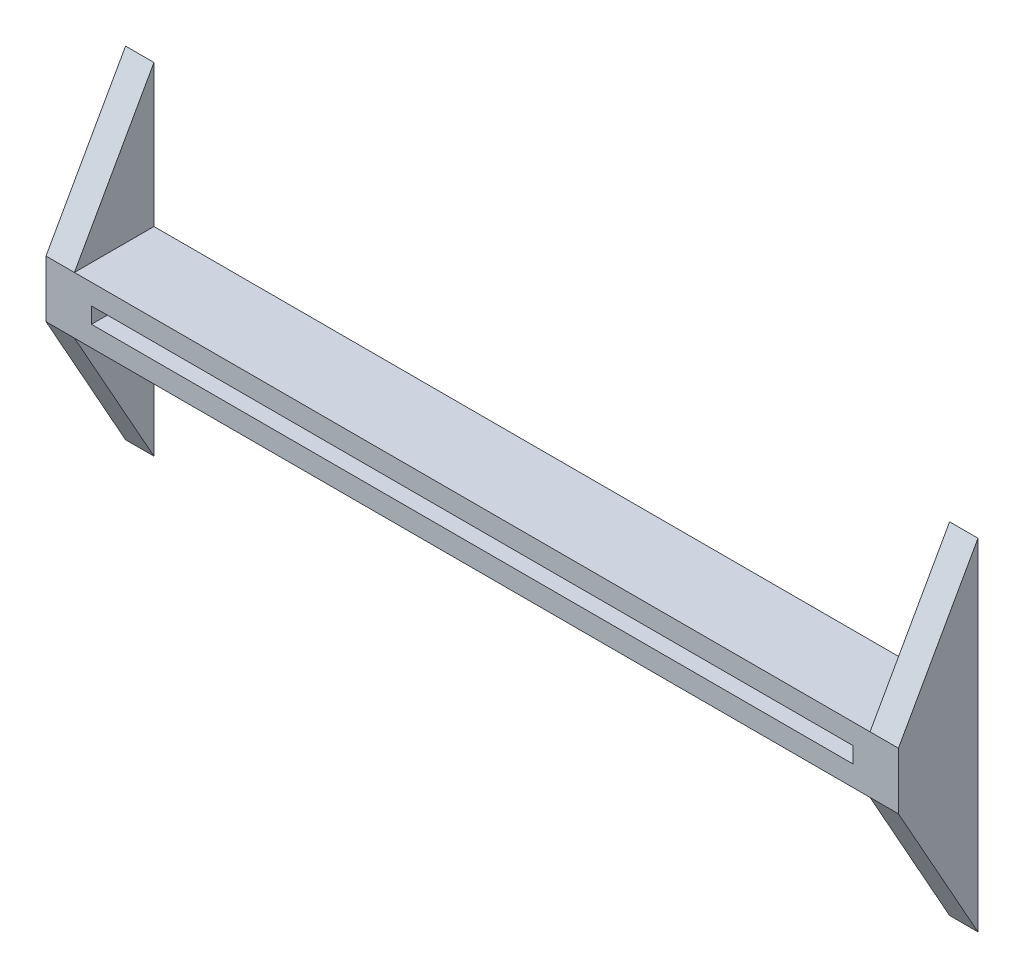
from build123d import *

# Parameters (mm, degrees)
SKETCH1_W           = 70
SKETCH1_H           = 5
SKETCH1_W_2         = 67
SKETCH1_H_2         = 1.4
BOSS_EXTRUDE1_DEPTH = 5
SKETCH2_W           = 70
SKETCH2_H           = 5
BOSS_EXTRUDE2_DEPTH = 2
BOSS_EXTRUDE3_DEPTH = 2.5
BOSS_EXTRUDE4_DEPTH = 2.5


with BuildPart() as part:
    # Sketch1 → Boss-Extrude1 (new body)
    with BuildSketch(Plane.XY):
        Rectangle(SKETCH1_W, SKETCH1_H)
        Rectangle(SKETCH1_W_2, SKETCH1_H_2, mode=Mode.SUBTRACT)
    extrude(amount=BOSS_EXTRUDE1_DEPTH)

    # Sketch2 → Boss-Extrude2 (add)
    with BuildSketch(Plane(origin=(0, 0, 0), x_dir=(-1, 0, 0), z_dir=(0, 0, -1))):
        Rectangle(SKETCH2_W, SKETCH2_H)
    extrude(amount=BOSS_EXTRUDE2_DEPTH)

    # Sketch3 → Boss-Extrude3 (add)
    with BuildSketch(Plane(origin=(35, 0, 0), x_dir=(0, 0, -1), z_dir=(1, 0, 0))):
        Polygon((-5, 2.5), (2, 15), (2, -15), (-5, -2.5), align=None)
    extrude(amount=BOSS_EXTRUDE3_DEPTH)

    # Sketch4 → Boss-Extrude4 (add)
    with BuildSketch(Plane.ZY.offset(35)):
        Polygon((5, 2.5), (-2, 15), (-2, -15), (5, -2.5), align=None)
    extrude(amount=BOSS_EXTRUDE4_DEPTH)


solid = part.part
